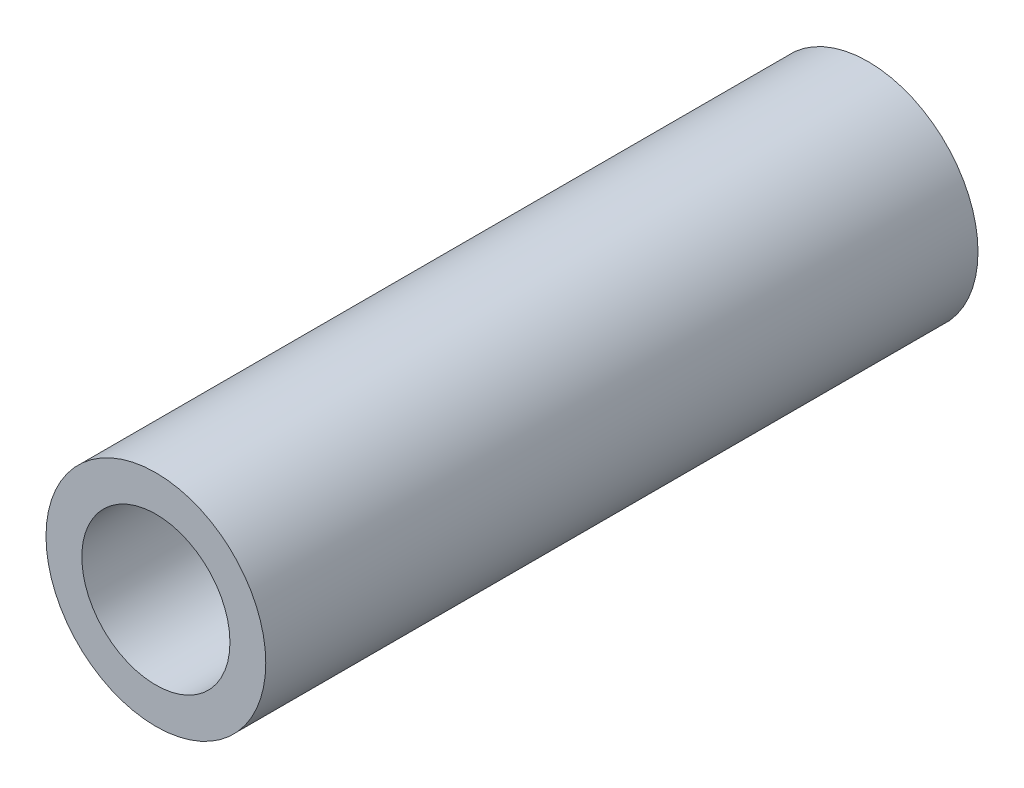
from build123d import *

# Parameters (mm, degrees)
SKETCH1_R      = 6.858
SKETCH1_R_2    = 4.6228
EXTRUDE1_DEPTH = 22.225


with BuildPart() as part:
    # Sketch1 → Extrude1 (new, symmetric)
    with BuildSketch(Plane.XY):
        Circle(SKETCH1_R)
        Circle(SKETCH1_R_2, mode=Mode.SUBTRACT)
    extrude(amount=EXTRUDE1_DEPTH, both=True)


solid = part.part
